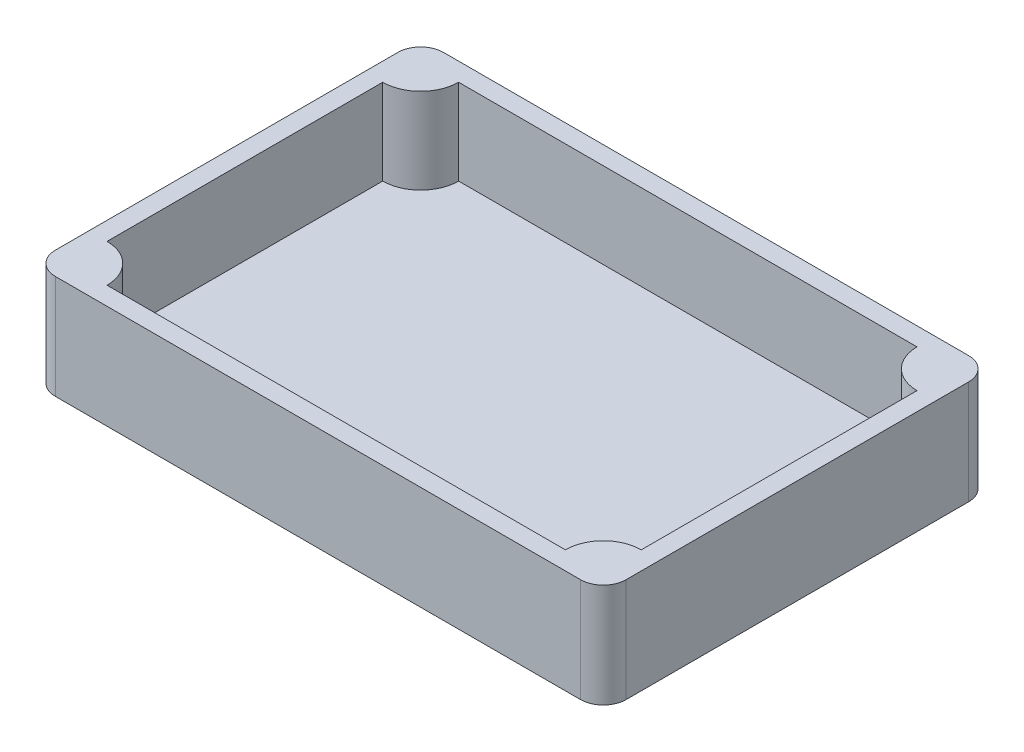
from build123d import *

# Parameters (mm, degrees)
BOSS_EXTRUDE1_DEPTH = 3.2
BOSS_EXTRUDE2_DEPTH = 15


with BuildPart() as part:
    # Sketch1 → Boss-Extrude1 (new body)
    with BuildSketch(Plane(origin=(0, 0, 0), x_dir=(1, 0, 0), z_dir=(0, 1, 0))):
        with BuildLine():
            Line((-46, -34), (46, -34))
            ThreePointArc((46, -34), (48.828427125, -32.828427125), (50, -30))
            Line((50, -30), (50, 30))
            ThreePointArc((50, 30), (48.828427125, 32.828427125), (46, 34))
            Line((46, 34), (-46, 34))
            ThreePointArc((-46, 34), (-48.828427125, 32.828427125), (-50, 30))
            Line((-50, 30), (-50, -30))
            ThreePointArc((-50, -30), (-48.828427125, -32.828427125), (-46, -34))
        make_face()
    extrude(amount=BOSS_EXTRUDE1_DEPTH)

    # Sketch2 → Boss-Extrude2 (add)
    with BuildSketch(Plane(origin=(0, 3.2, 0), x_dir=(1, 0, 0), z_dir=(0, 1, 0))):
        with BuildLine():
            ThreePointArc((-48.594612634, -33.044336591), (-47.382507439, -33.753488135), (-46, -34))
            Line((-46, -34), (46, -34))
            ThreePointArc((46, -34), (48.828427125, -32.828427125), (50, -30))
            Line((50, -30), (50, 30))
            ThreePointArc((50, 30), (48.828427125, 32.828427125), (46, 34))
            Line((46, 34), (-46, 34))
            ThreePointArc((-46, 34), (-47.382507439, 33.753488135), (-48.594612634, 33.044336591))
            ThreePointArc((-48.594612634, 33.044336591), (-49.631697298, 31.676536529), (-50, 30))
            Line((-50, 30), (-50, -27.196030412))
            Line((-50, -27.196030412), (-50, -30))
            ThreePointArc((-50, -30), (-49.631697298, -31.676536529), (-48.594612634, -33.044336591))
        make_face()
        with BuildLine():
            ThreePointArc((-41.245050157, -27.144178308), (-43.644743612, -24.94621002), (-46.8, -24.15))
            Line((-46.8, -24.15), (-46.8, 24.15))
            ThreePointArc((-46.8, 24.15), (-43.644743612, 24.94621002), (-41.245050157, 27.144178308))
            ThreePointArc((-41.245050157, 27.144178308), (-40.429642221, 28.891848598), (-40.15, 30.8))
            Line((-40.15, 30.8), (40.166928077, 30.8))
            ThreePointArc((40.166928077, 30.8), (40.445858448, 28.896705942), (41.259190701, 27.153484478))
            ThreePointArc((41.259190701, 27.153484478), (43.652775555, 24.961111285), (46.8, 24.166928077))
            Line((46.8, 24.166928077), (46.8, -24.15))
            ThreePointArc((46.8, -24.15), (43.644743612, -24.94621002), (41.245050157, -27.144178308))
            ThreePointArc((41.245050157, -27.144178308), (40.429642221, -28.891848598), (40.15, -30.8))
            Line((40.15, -30.8), (-40.15, -30.8))
            ThreePointArc((-40.15, -30.8), (-40.429642221, -28.891848598), (-41.245050157, -27.144178308))
        make_face(mode=Mode.SUBTRACT)
    extrude(amount=BOSS_EXTRUDE2_DEPTH)


solid = part.part
